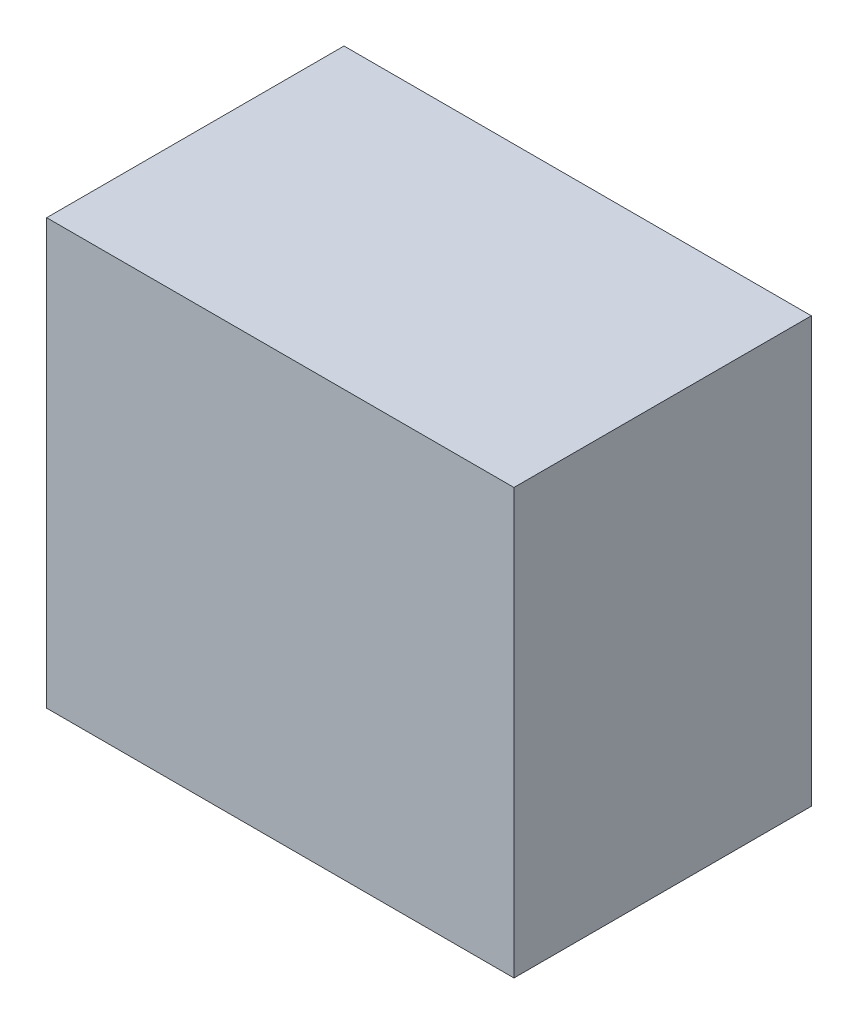
from build123d import *

# Parameters (mm, degrees)
CROQUIS1_W              = 550
CROQUIS1_H              = 500
SALIENTE_EXTRUIR1_DEPTH = 350


with BuildPart() as part:
    # Croquis1 → Saliente-Extruir1 (new body)
    with BuildSketch(Plane.XY):
        with Locations((275, 250)):
            Rectangle(CROQUIS1_W, CROQUIS1_H)
    extrude(amount=SALIENTE_EXTRUIR1_DEPTH)


solid = part.part
